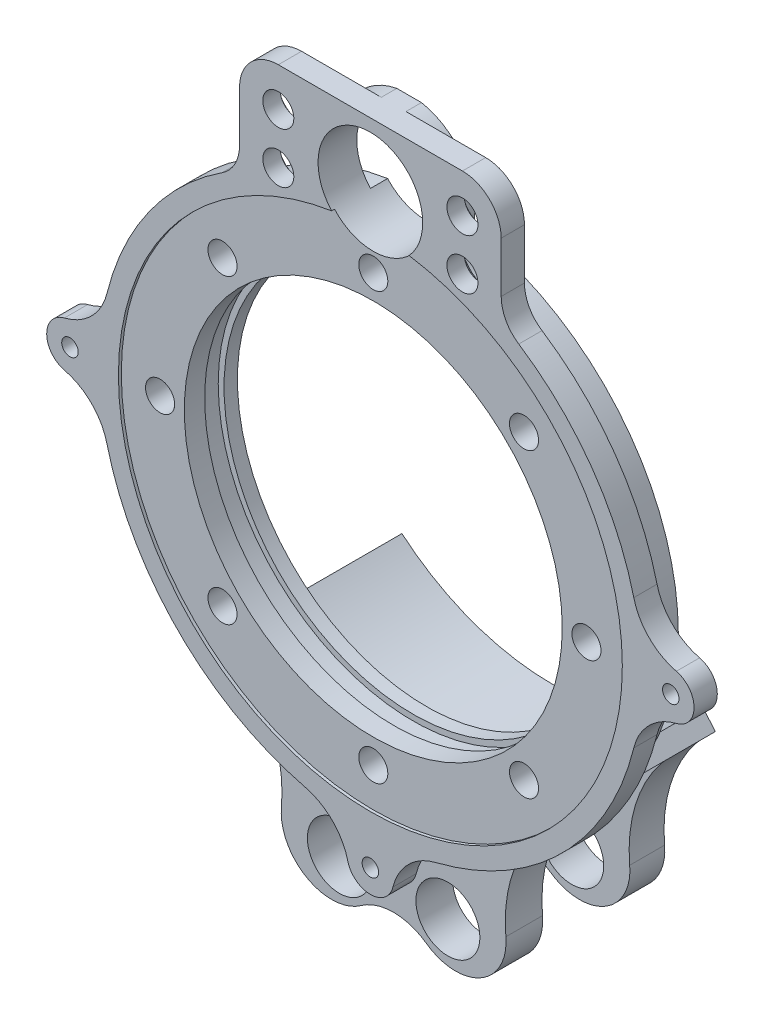
from build123d import *

# Parameters (mm, degrees)
SKETCH2_R                      = 140
SKETCH2_R_2                    = 130
EXTRUDE_294_DEPTH              = 12
EXTRUDE_START                  = -1.5
SKETCH3_R                      = 130
SKETCH3_R_2                    = 97.5
EXTRUDE_435_DEPTH              = 27.4
EXTRUDE_755_DEPTH              = 12
FILLET_1_R                     = 20
FILLET_2_R                     = 20
CUT_EXTRUDE_1525_DEPTH         = 230.859109021
CUT_EXTRUDE_1525_DEPTH_BACK    = 230.859109021
SKETCH5_R                      = 27
SKETCH5_R_2                    = 8
EXTRUDE_START_2                = -20
SKETCH7_R                      = 27
EXTRUDE_1830_DEPTH             = 8
FILLET_1915_R                  = 20
CUT_EXTRUDE_START              = -3
SKETCH8_R                      = 12
SKETCH8_R_2                    = 8
CUT_EXTRUDE_2475_DEPTH         = 3
CUT_EXTRUDE_2922_DEPTH         = 230.859109173
CUT_EXTRUDE_2922_DEPTH_BACK    = 230.859109173
SKETCH9_R                      = 7.5
SKETCH10_R                     = 4.25
EXTRUDE_3348_DEPTH             = 12
FILLET_3432_R                  = 30
CUT_EXTRUDE_START_2            = -10.5
SKETCH12_R                     = 100.5
CUT_EXTRUDE_4103_DEPTH         = 10
SKETCH13_R                     = 16.5
EXTRUDE_5343_DEPTH             = 65
EXTRUDE_5343_DIRECTION_2_REACH = 249.233
CUT_EXTRUDE_START_3            = -18
SKETCH17_OUTSIDE_W             = 437.63
SKETCH17_OUTSIDE_H             = 474.897
SKETCH17_OUTSIDE_R             = 130
CUT_EXTRUDE_5591_DEPTH         = 45


with BuildPart() as part:
    # Sketch2 → Extrude 294 (new body)
    with BuildSketch(Plane.XY):
        Circle(SKETCH2_R)
        Circle(SKETCH2_R_2, mode=Mode.SUBTRACT)
    extrude(amount=-EXTRUDE_294_DEPTH)

    # Sketch3 → Extrude 435 (add)
    with BuildSketch(Plane.XY.offset(EXTRUDE_START)):
        Circle(SKETCH3_R)
        Circle(SKETCH3_R_2, mode=Mode.SUBTRACT)
    extrude(amount=-EXTRUDE_435_DEPTH)

    # Sketch4 → Extrude 755 (add)
    with BuildSketch(Plane.XY):
        with BuildLine():
            Line((-67.5, 111.102430216), (-67.5, 180))
            Line((-67.5, 180), (67.5, 180))
            Line((67.5, 180), (67.5, 111.102430216))
            ThreePointArc((67.5, 111.102430216), (0, 130), (-67.5, 111.102430216))
        make_face()
    extrude(amount=-EXTRUDE_755_DEPTH)

    # ВерхПриспосОкругл1
    fillet_1_edges = [part.edges().sort_by_distance(p)[0] for p in [
        (-67.5, 180, -6),
        (67.5, 180, -6),
    ]]
    fillet(fillet_1_edges, radius=FILLET_1_R)

    # ВерхПриспосОкругл2
    fillet_2_edges = [part.edges().sort_by_distance(p)[0] for p in [
        (-67.5, 122.65296572, -6),
        (67.5, 122.65296572, -6),
    ]]
    fillet(fillet_2_edges, radius=FILLET_2_R)

    # Sketch5 → Cut-Extrude 1525 (cut, two sides: drawn at the far end of the back side and taken through both)
    with BuildSketch(Plane.XY.offset(-CUT_EXTRUDE_1525_DEPTH_BACK)):
        with Locations(Location((0, 146.6, 0), (0, 0, 317.771161131))):
            Circle(SKETCH5_R)
        with Locations((-47.5, 160)):
            Circle(SKETCH5_R_2)
        with Locations((47.5, 160)):
            Circle(SKETCH5_R_2)
        with Locations((-47.5, 133.954283246)):
            Circle(SKETCH5_R_2)
        with Locations((47.5, 133.954283246)):
            Circle(SKETCH5_R_2)
    extrude(amount=CUT_EXTRUDE_1525_DEPTH + CUT_EXTRUDE_1525_DEPTH_BACK, mode=Mode.SUBTRACT)

    # Sketch7 → Extrude 1830 (add)
    with BuildSketch(Plane.XY.offset(EXTRUDE_START_2)):
        with BuildLine():
            Line((-6.359245238, 180), (6.359245238, 180))
            ThreePointArc((6.359245238, 180), (0, 112.6), (-6.359245238, 180))
        make_face()
        with Locations(Location((0, 146.6, 0), (0, 0, 317.771161131))):
            Circle(SKETCH7_R, mode=Mode.SUBTRACT)
    extrude(amount=EXTRUDE_1830_DEPTH)

    # Fillet 1915
    fillet_1915_edges = [part.edges().sort_by_distance(p)[0] for p in [
        (-27.779987153, 126.997135061, -16),
        (27.779987153, 126.997135061, -16),
    ]]
    fillet(fillet_1915_edges, radius=FILLET_1915_R)

    # Sketch8 → Cut-Extrude 2475 (cut)
    # profile 1 of 4: a face of its own
    with BuildSketch(Plane(origin=(0, 0, -12), x_dir=(-1, 0, 0), z_dir=(0, 0, -1)).offset(CUT_EXTRUDE_START)):
        with Locations((-47.5, 160)):
            Circle(SKETCH8_R)
        with Locations(Location((-47.5, 160, 0), (0, 0, 180))):
            Circle(SKETCH8_R_2, mode=Mode.SUBTRACT)
    # profile 2 of 4: a face of its own
    with BuildSketch(Plane(origin=(0, 0, -12), x_dir=(-1, 0, 0), z_dir=(0, 0, -1)).offset(CUT_EXTRUDE_START)):
        with Locations(Location((-47.5, 133.954283246, 0), (0, 0, 344.273345201))):
            Circle(SKETCH8_R)
        with Locations(Location((-47.5, 133.954283246, 0), (0, 0, 180))):
            Circle(SKETCH8_R_2, mode=Mode.SUBTRACT)
    # profile 3 of 4: a face of its own
    with BuildSketch(Plane(origin=(0, 0, -12), x_dir=(-1, 0, 0), z_dir=(0, 0, -1)).offset(CUT_EXTRUDE_START)):
        with Locations((47.5, 160)):
            Circle(SKETCH8_R)
        with Locations(Location((47.5, 160, 0), (0, 0, 180))):
            Circle(SKETCH8_R_2, mode=Mode.SUBTRACT)
    # profile 4 of 4: a face of its own
    with BuildSketch(Plane(origin=(0, 0, -12), x_dir=(-1, 0, 0), z_dir=(0, 0, -1)).offset(CUT_EXTRUDE_START)):
        with Locations(Location((47.5, 133.954283246, 0), (0, 0, 254.582817964))):
            Circle(SKETCH8_R)
        with Locations(Location((47.5, 133.954283246, 0), (0, 0, 180))):
            Circle(SKETCH8_R_2, mode=Mode.SUBTRACT)
    extrude(amount=CUT_EXTRUDE_2475_DEPTH, mode=Mode.SUBTRACT)

    # Sketch9 → Cut-Extrude 2922 (cut, two sides: drawn at the far end of the back side and taken through both)
    with BuildSketch(Plane.XY.offset(-CUT_EXTRUDE_2922_DEPTH_BACK)):
        with Locations((0, 110)):
            Circle(SKETCH9_R)
        with Locations((77.781745931, 77.781745931)):
            Circle(SKETCH9_R)
        with Locations((110, 0)):
            Circle(SKETCH9_R)
        with Locations((77.781745931, -77.781745931)):
            Circle(SKETCH9_R)
        with Locations((0, -110)):
            Circle(SKETCH9_R)
        with Locations((-77.781745931, -77.781745931)):
            Circle(SKETCH9_R)
        with Locations((-110, 0)):
            Circle(SKETCH9_R)
        with Locations((-77.781745931, 77.781745931)):
            Circle(SKETCH9_R)
    extrude(amount=CUT_EXTRUDE_2922_DEPTH + CUT_EXTRUDE_2922_DEPTH_BACK, mode=Mode.SUBTRACT)

    # Sketch10 → Extrude 3348 (add)
    # profile 1 of 3: a face of its own
    with BuildSketch(Plane.XY):
        with BuildLine():
            Line((-155, 12), (-139.484766193, 12))
            Line((-139.484766193, 12), (-139.484766193, -12))
            Line((-139.484766193, -12), (-155, -12))
            ThreePointArc((-155, -12), (-167, 0), (-155, 12))
        make_face()
        with Locations((-155, 0)):
            Circle(SKETCH10_R, mode=Mode.SUBTRACT)
    # profile 2 of 3: a face of its own
    with BuildSketch(Plane.XY):
        with BuildLine():
            Line((-12, -139.484766193), (12, -139.484766193))
            Line((12, -139.484766193), (12, -155))
            ThreePointArc((12, -155), (0, -167), (-12, -155))
            Line((-12, -155), (-12, -139.484766193))
        make_face()
        with Locations((0, -155)):
            Circle(SKETCH10_R, mode=Mode.SUBTRACT)
    # profile 3 of 3: a face of its own
    with BuildSketch(Plane.XY):
        with BuildLine():
            Line((139.484766193, -12), (139.484766193, 12))
            Line((139.484766193, 12), (155, 12))
            ThreePointArc((155, 12), (167, 0), (155, -12))
            Line((155, -12), (139.484766193, -12))
        make_face()
        with Locations((155, 0)):
            Circle(SKETCH10_R, mode=Mode.SUBTRACT)
    extrude(amount=-EXTRUDE_3348_DEPTH)

    # Fillet 3432
    fillet_3432_edges = [part.edges().sort_by_distance(p)[0] for p in [
        (-139.484766193, -12, -6),
        (-139.484766193, 12, -6),
        (139.484766193, 12, -6),
        (139.484766193, -12, -6),
        (12, -139.484766193, -6),
        (-12, -139.484766193, -6),
    ]]
    fillet(fillet_3432_edges, radius=FILLET_3432_R)

    # Sketch12 → Cut-Extrude 4103 (cut)
    with BuildSketch(Plane.XY.offset(-1.5).offset(CUT_EXTRUDE_START_2)):
        Circle(SKETCH12_R)
    extrude(amount=-CUT_EXTRUDE_4103_DEPTH, mode=Mode.SUBTRACT)

    # Sketch13 → Extrude 5343 (add)
    with BuildSketch(Plane(origin=(0, 0, -28.9), x_dir=(-1, 0, 0), z_dir=(0, 0, -1))):
        with BuildLine():
            Line((-84.090568802, -99.140184782), (-77.62206351, -91.514016722))
            ThreePointArc((-77.62206351, -91.514016722), (0, -120), (77.62206351, -91.514016722))
            Line((77.62206351, -91.514016722), (84.090568802, -99.140184782))
            ThreePointArc((84.090568802, -99.140184782), (63.219188855, -127.863682213), (57.898151692, -162.968388011))
            ThreePointArc((57.898151692, -162.968388011), (44.900551795, -187.841246378), (16.872727273, -186.413752431))
            ThreePointArc((16.872727273, -186.413752431), (0, -181), (-16.872727273, -186.413752431))
            ThreePointArc((-16.872727273, -186.413752431), (-44.900551795, -187.841246378), (-57.898151692, -162.968388011))
            ThreePointArc((-57.898151692, -162.968388011), (-63.219188855, -127.863682213), (-84.090568802, -99.140184782))
        make_face()
        with Locations((-28, -170)):
            Circle(SKETCH13_R, mode=Mode.SUBTRACT)
        with Locations((28, -170)):
            Circle(SKETCH13_R, mode=Mode.SUBTRACT)
    extrude(amount=EXTRUDE_5343_DEPTH)

    # Extrude 5343 direction 2: up to this face of the body (flat: up to its plane)
    extrude_5343_direction_2_end = Plane(part.part.faces().sort_by_distance((-110.241259527, 78.240043066, -12))[0])
    # Sketch13 → Extrude 5343 direction 2 (add, up to the picked face)
    with BuildSketch(Plane(origin=(0, 0, -28.9), x_dir=(-1, 0, 0), z_dir=(0, 0, -1)), mode=Mode.PRIVATE) as extrude_5343_direction_2_sk1:
        with BuildLine():
            Line((-84.090568802, -99.140184782), (-77.62206351, -91.514016722))
            ThreePointArc((-77.62206351, -91.514016722), (0, -120), (77.62206351, -91.514016722))
            Line((77.62206351, -91.514016722), (84.090568802, -99.140184782))
            ThreePointArc((84.090568802, -99.140184782), (63.219188855, -127.863682213), (57.898151692, -162.968388011))
            ThreePointArc((57.898151692, -162.968388011), (44.900551795, -187.841246378), (16.872727273, -186.413752431))
            ThreePointArc((16.872727273, -186.413752431), (0, -181), (-16.872727273, -186.413752431))
            ThreePointArc((-16.872727273, -186.413752431), (-44.900551795, -187.841246378), (-57.898151692, -162.968388011))
            ThreePointArc((-57.898151692, -162.968388011), (-63.219188855, -127.863682213), (-84.090568802, -99.140184782))
        make_face()
        with Locations((-28, -170)):
            Circle(SKETCH13_R, mode=Mode.SUBTRACT)
        with Locations((28, -170)):
            Circle(SKETCH13_R, mode=Mode.SUBTRACT)
    extrude_5343_direction_2_tool1 = split(extrude(extrude_5343_direction_2_sk1.sketch, amount=-EXTRUDE_5343_DIRECTION_2_REACH, mode=Mode.PRIVATE), bisect_by=extrude_5343_direction_2_end, keep=Keep.BOTH, mode=Mode.PRIVATE)
    add(extrude_5343_direction_2_tool1.solids().sort_by(Axis((0, -141.005893, -28.9), (0, 0, 1)))[0])

    # Sketch17 outside → Cut-Extrude 5591 (cut)
    with BuildSketch(Plane(origin=(0, 0, -93.9), x_dir=(-1, 0, 0), z_dir=(0, 0, -1)).offset(CUT_EXTRUDE_START_3)):
        with Locations((0, -5.6335)):
            Rectangle(SKETCH17_OUTSIDE_W, SKETCH17_OUTSIDE_H)
        Circle(SKETCH17_OUTSIDE_R, mode=Mode.SUBTRACT)
    extrude(amount=-CUT_EXTRUDE_5591_DEPTH, mode=Mode.SUBTRACT)


solid = part.part
